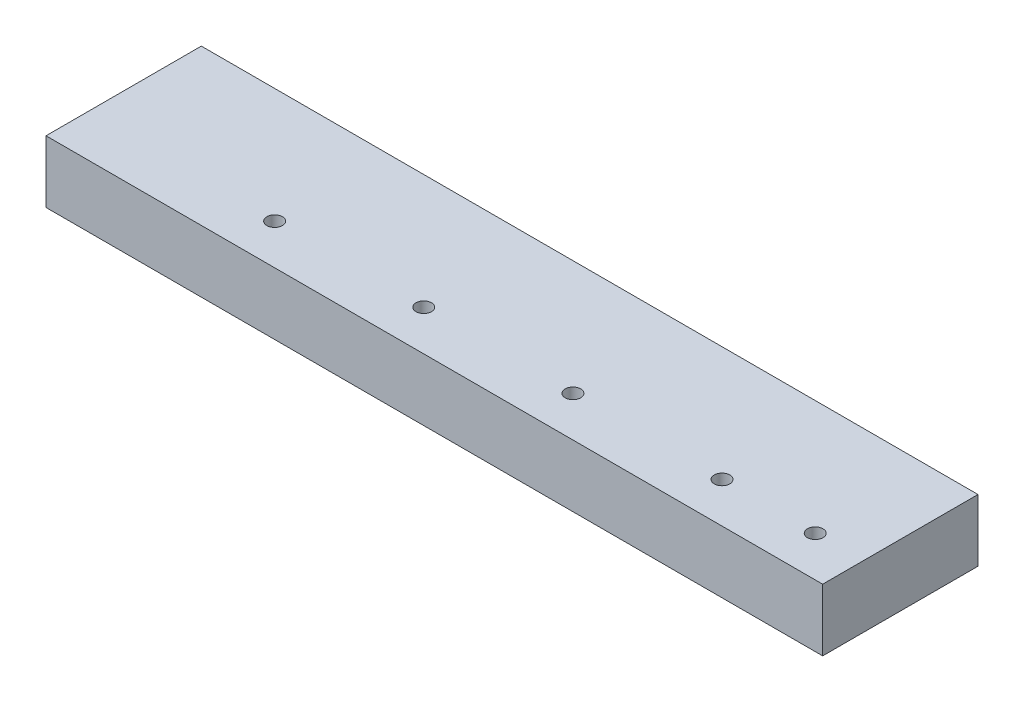
from build123d import *

# Parameters (mm, degrees)
SKETCH_1_W      = 125
SKETCH_1_H      = 10
EXTRUDE_1_DEPTH = 25
M3X0_52_D       = 2.5
M3X0_52_DEPTH   = 12.5
M3X0_52_TIP     = 0.751075774
M3X0_51_D       = 2.5


with BuildPart() as part:
    # Эскиз1 → Бобышка-Вытянуть1 (new body)
    with BuildSketch(Plane.XY):
        with Locations((5.147947656, -18.350453001)):
            Rectangle(SKETCH_1_W, SKETCH_1_H)
    extrude(amount=EXTRUDE_1_DEPTH)

    # Отверстие обработанное метчиком M3x0.52
    with Locations(Plane(origin=(0, 0, 0), x_dir=(-1, 0, 0), z_dir=(0, 0, -1))):
        with Locations((-62.647947656, -18.350453001), (52.352052344, -18.350453001)):
            Hole(M3X0_52_D / 2, depth=M3X0_52_DEPTH)
            with Locations((0, 0, -(M3X0_52_DEPTH + M3X0_52_TIP / 2))):  # 118° drill point
                Cone(0, M3X0_52_D / 2, M3X0_52_TIP, mode=Mode.SUBTRACT)

    # Отверстие обработанное метчиком M3x0.51 (through all)
    with Locations(Plane(origin=(0, -13.350453001, 0), x_dir=(-1, 0, 0), z_dir=(0, 1, 0))):
        with Locations((-44.947947656, 18.5), (-20.947947656, 18.5), (3.052052344, 18.5), (27.052052344, 18.5), (-59.947947656, 18.5)):
            Hole(M3X0_51_D / 2)


solid = part.part
